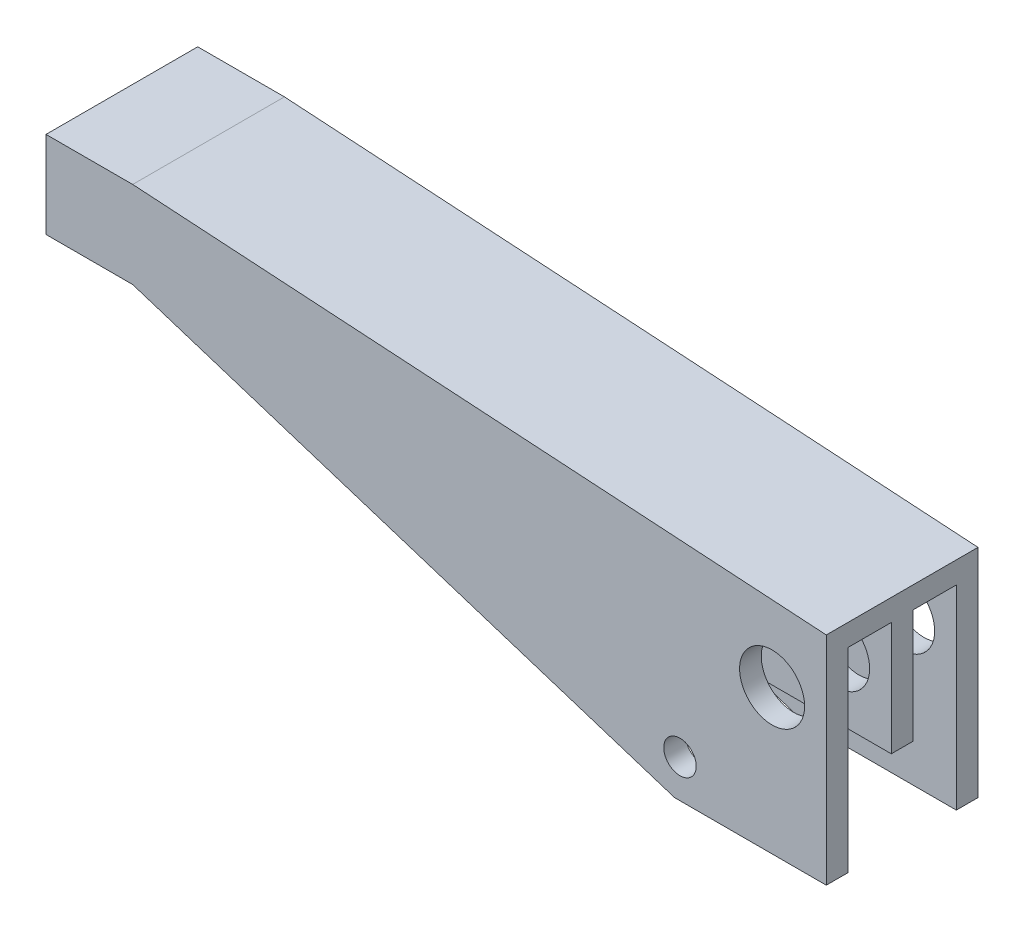
from build123d import *

# Parameters (mm, degrees)
BOSS_EXTRUDE1_DEPTH      = 25.4
BOSS_EXTRUDE2_DEPTH      = 25.4
BOSS_EXTRUDE3_DEPTH      = 152.4
BOSS_EXTRUDE4_DEPTH      = 12.7
BOSS_EXTRUDE4_DEPTH_BACK = 12.7
SKETCH5_R                = 38.1
SKETCH5_R_2              = 19.05
CUT_EXTRUDE1_DEPTH       = 981.124094184
CUT_EXTRUDE2_DEPTH       = 25.4


with BuildPart() as part:
    # Sketch1 → Boss-Extrude1 (new body)
    with BuildSketch(Plane.XY):
        Polygon((-914.4, 304.8), (-812.8, 304.8), (0, 254), (0, 0), (-177.8, 0), (-812.8, 203.2), (-914.4, 203.2), align=None)
    extrude(amount=-BOSS_EXTRUDE1_DEPTH)



with BuildPart() as body_2:
    # Sketch2 → Boss-Extrude2 (new body)
    with BuildSketch(Plane.XY.offset(127)):
        Polygon((-812.8, 203.2), (-177.8, 0), (0, 0), (0, 254), (-812.8, 304.8), (-914.4, 304.8), (-914.4, 203.2), align=None)
    extrude(amount=BOSS_EXTRUDE2_DEPTH)


with BuildPart() as part_1:
    add(part.part)

    add(body_2.part)  # Boss-Extrude3 merges body 2
    # Sketch3 → Boss-Extrude3 (add)
    with BuildSketch(Plane.XY.offset(152.4)):
        Polygon((-914.4, 279.4), (-914.4, 304.8), (-812.8, 304.8), (0, 254), (0, 228.550438977), (-25.4, 230.137938977), (-813.592976364, 279.4), align=None)
    extrude(amount=-BOSS_EXTRUDE3_DEPTH)

    # Sketch6 → Boss-Extrude4 (add, two sides: drawn at the far end of the back side and taken through both)
    with BuildSketch(Plane.XY.offset(63.5).offset(-BOSS_EXTRUDE4_DEPTH_BACK)):
        Polygon((-812.8, 203.2), (-177.8, 0), (0, 0), (0, 254), (-812.8, 304.8), (-914.4, 304.8), (-914.4, 203.2), align=None)
    extrude(amount=BOSS_EXTRUDE4_DEPTH + BOSS_EXTRUDE4_DEPTH_BACK)

    # Sketch5 → Cut-Extrude1 (cut, through all)
    with BuildSketch(Plane.XY.offset(152.4)):
        with Locations((-63.5, 168.969627955)):
            Circle(SKETCH5_R)
        with Locations((-171.45, 44.45)):
            Circle(SKETCH5_R_2)
    extrude(amount=-CUT_EXTRUDE1_DEPTH, mode=Mode.SUBTRACT)

    # Sketch7 → Cut-Extrude2 (cut)
    with BuildSketch(Plane.XY.offset(76.2)):
        Polygon((-475.45625, 95.25), (0, 95.25), (0, 0), (-177.8, 0), align=None)
    extrude(amount=-CUT_EXTRUDE2_DEPTH, mode=Mode.SUBTRACT)


solid = part_1.part
